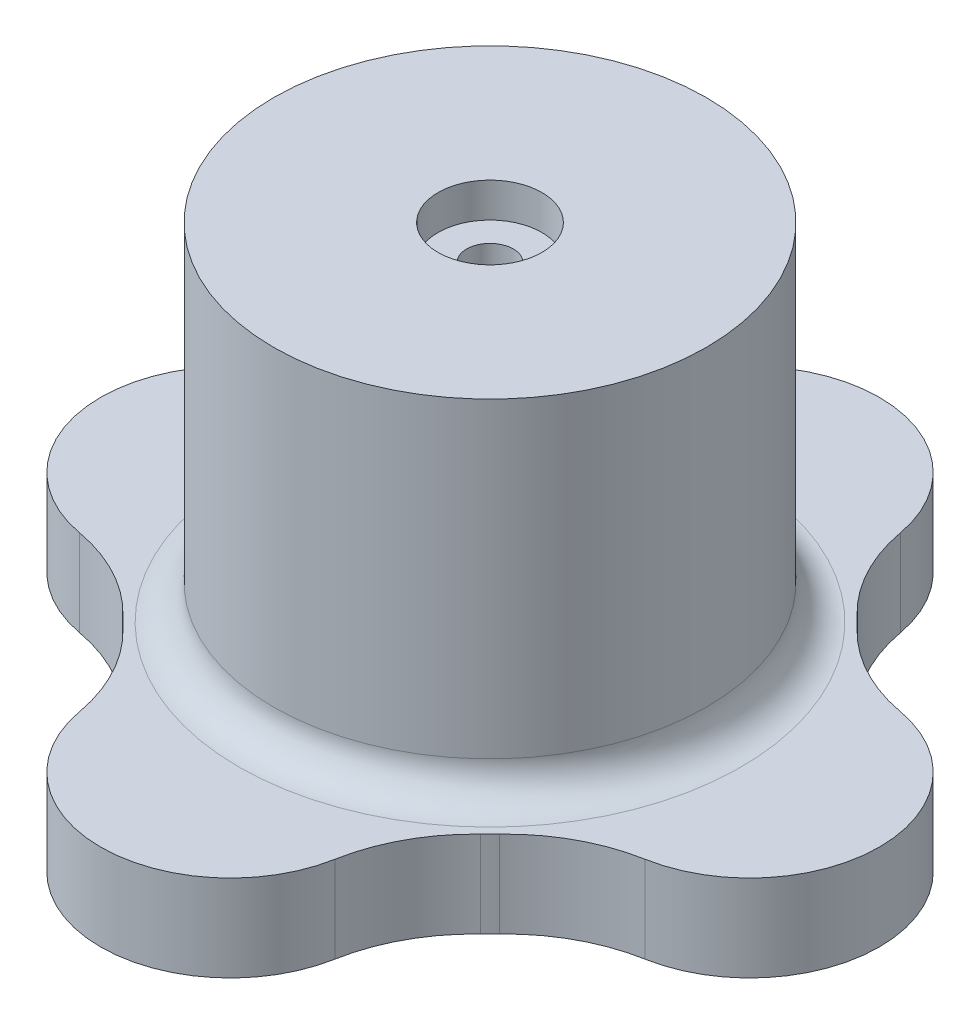
from build123d import *

# Parameters (mm, degrees)
BOSS_EXTRUDE1_DEPTH = 5
FILLET1_R           = 10
SKETCH3_R           = 12.5
BOSS_EXTRUDE2_DEPTH = 20
SKETCH4_R           = 1.35
CUT_EXTRUDE1_DEPTH  = 20
SKETCH5_R           = 3
CUT_EXTRUDE2_DEPTH  = 2
FILLET3_R           = 2


with BuildPart() as part:
    # Sketch2 → Boss-Extrude1 (new body)
    with BuildSketch(Plane(origin=(0, 0, 0), x_dir=(1, 0, 0), z_dir=(0, 1, 0))):
        with BuildLine():
            ThreePointArc((-13.125, -7.261843774), (-10.606601718, -10.606601718), (-7.261843774, -13.125))
            ThreePointArc((-7.261843774, -13.125), (0, -22.5), (7.261843774, -13.125))
            ThreePointArc((7.261843774, -13.125), (10.606601718, -10.606601718), (13.125, -7.261843774))
            ThreePointArc((13.125, -7.261843774), (22.5, 0), (13.125, 7.261843774))
            ThreePointArc((13.125, 7.261843774), (10.606601718, 10.606601718), (7.261843774, 13.125))
            ThreePointArc((7.261843774, 13.125), (0, 22.5), (-7.261843774, 13.125))
            ThreePointArc((-7.261843774, 13.125), (-10.606601718, 10.606601718), (-13.125, 7.261843774))
            ThreePointArc((-13.125, 7.261843774), (-22.5, 0), (-13.125, -7.261843774))
        make_face()
    extrude(amount=BOSS_EXTRUDE1_DEPTH)

    # Fillet1
    fillet1_edges = [part.edges().sort_by_distance(p)[0] for p in [
        (-13.125, 2.5, 7.261843774),
        (-13.125, 2.5, -7.261843774),
        (-7.261843774, 2.5, -13.125),
        (7.261843774, 2.5, -13.125),
        (13.125, 2.5, -7.261843774),
        (13.125, 2.5, 7.261843774),
        (7.261843774, 2.5, 13.125),
        (-7.261843774, 2.5, 13.125),
    ]]
    fillet(fillet1_edges, radius=FILLET1_R)

    # Sketch3 → Boss-Extrude2 (add)
    with BuildSketch(Plane(origin=(0, 5, 0), x_dir=(1, 0, 0), z_dir=(0, 1, 0))):
        with Locations(Location((0, 0, 0), (0, 0, 270))):
            Circle(SKETCH3_R)
    extrude(amount=BOSS_EXTRUDE2_DEPTH)

    # Sketch4 → Cut-Extrude1 (cut)
    with BuildSketch(Plane(origin=(0, 25, 0), x_dir=(1, 0, 0), z_dir=(0, 1, 0))):
        with Locations(Location((0, 0, 0), (0, 0, 270))):
            Circle(SKETCH4_R)
    extrude(amount=-CUT_EXTRUDE1_DEPTH, mode=Mode.SUBTRACT)

    # Sketch5 → Cut-Extrude2 (cut)
    with BuildSketch(Plane(origin=(0, 25, 0), x_dir=(1, 0, 0), z_dir=(0, 1, 0))):
        with Locations(Location((0, 0, 0), (0, 0, 270))):
            Circle(SKETCH5_R)
    extrude(amount=-CUT_EXTRUDE2_DEPTH, mode=Mode.SUBTRACT)

    # Fillet3
    fillet3_edges = [part.edges().sort_by_distance(p)[0] for p in [
        (0, 5, -12.5),
    ]]
    fillet(fillet3_edges, radius=FILLET3_R)


solid = part.part
